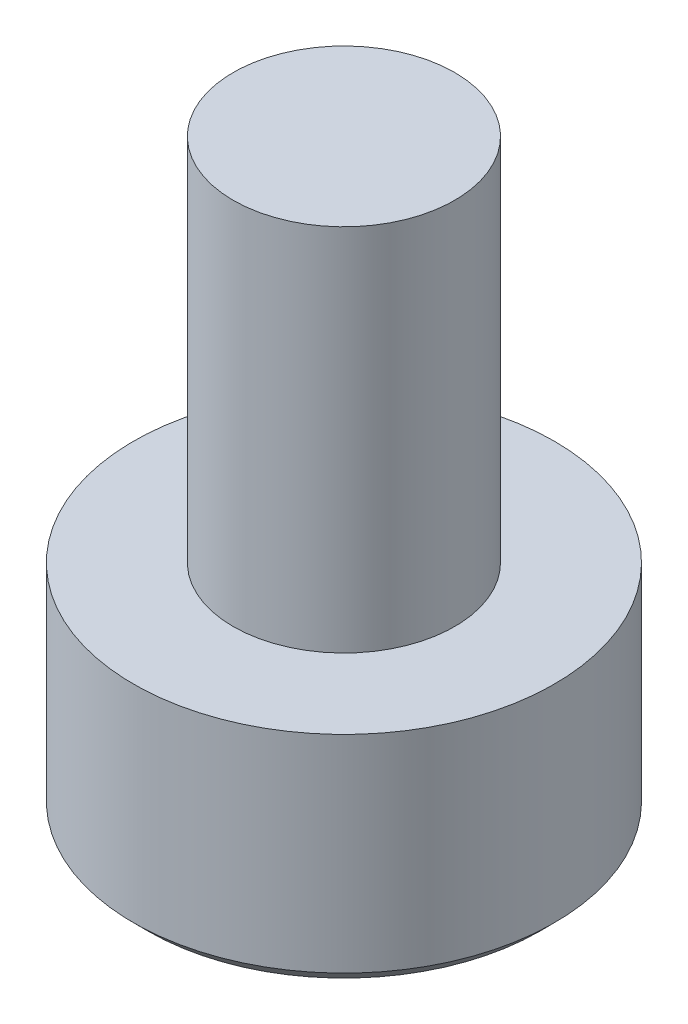
from build123d import *

# Parameters (mm, degrees)
SKETCH_1_R          = 1.5
EXTRUDE_1_DEPTH     = 5
SKETCH_2_R          = 2.85
EXTRUDE_2_DEPTH     = 3
CUT_EXTRUDE_1_DEPTH = 1
CHAMFER_1_SIZE      = 0.2


with BuildPart() as part:
    # 草图1 → 凸台-拉伸1 (new body)
    with BuildSketch(Plane(origin=(0, 0, 0), x_dir=(1, 0, 0), z_dir=(0, 1, 0))):
        with Locations(Location((0, 0, 0), (0, 0, 270))):
            Circle(SKETCH_1_R)
    extrude(amount=EXTRUDE_1_DEPTH)

    # 草图2 → 凸台-拉伸2 (add)
    with BuildSketch(Plane.XZ):
        with Locations(Location((0, 0, 0), (0, 0, 270))):
            Circle(SKETCH_2_R)
    extrude(amount=EXTRUDE_2_DEPTH)

    # 草图3 → 切除-拉伸1 (cut)
    with BuildSketch(Plane.XZ.offset(3)):
        Polygon((1.443375673, 0), (0.721687836, 1.25), (-0.721687836, 1.25), (-1.443375673, 0), (-0.721687836, -1.25), (0.721687836, -1.25), align=None)
    extrude(amount=-CUT_EXTRUDE_1_DEPTH, mode=Mode.SUBTRACT)

    # 倒角1
    chamfer_1_edges = [part.edges().sort_by_distance(p)[0] for p in [
        (0, -3, 2.85),
    ]]
    chamfer(chamfer_1_edges, length=CHAMFER_1_SIZE)


solid = part.part
